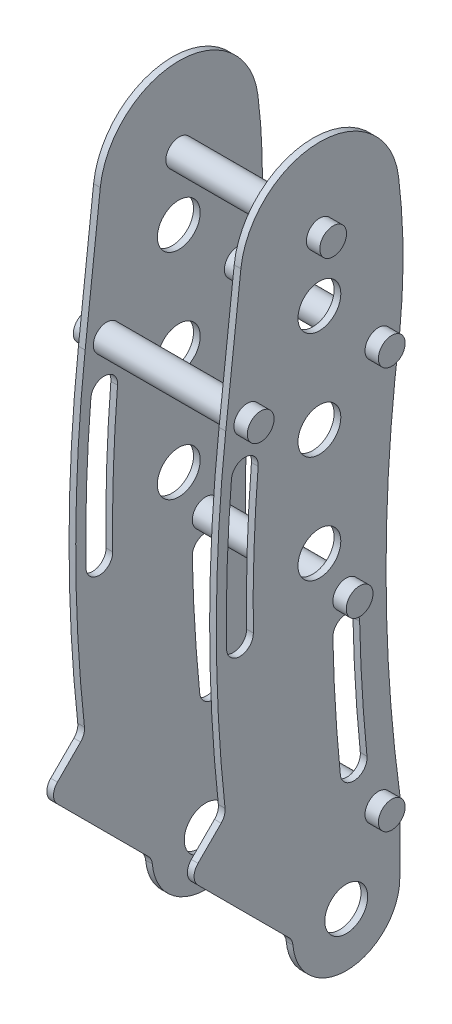
from build123d import *

# Parameters (mm, degrees)
DODANIE_WYCI_GNI_CIE1_DEPTH      = 27.5
DODANIE_WYCI_GNI_CIE1_DEPTH_BACK = 27.5
SZKIC1_R                         = 8
WYTNIJ_WYCI_GNI_CIE3_DEPTH       = 262.225344217
WYTNIJ_WYCI_GNI_CIE3_DEPTH_BACK  = 262.225344217
SZKIC2_W                         = 50
SZKIC2_H                         = 271.010465283
DODANIE_WYCI_GNI_CIE2_DEPTH      = 32.5
DODANIE_WYCI_GNI_CIE2_DEPTH_BACK = 32.5
SZKIC4_R                         = 5
WYTNIJ_WYCI_GNI_CIE4_DEPTH       = 262.79893136
WYTNIJ_WYCI_GNI_CIE4_DEPTH_BACK  = 262.79893136
SZKIC5_W                         = 50
SZKIC5_H                         = 2
SZKIC7_R                         = 8
WYTNIJ_WYCI_GNI_CIE5_DEPTH       = 267.612885025
ZAOKR_GLENIE1_R                  = 5


with BuildPart() as part:
    # Szkic1 → Dodanie-wyciągnięcie1 (new, two sides: drawn at the far end of the back side and taken through both)
    with BuildSketch(Plane(origin=(0, 0, 0), x_dir=(0, 0, -1), z_dir=(1, 0, 0)).offset(-DODANIE_WYCI_GNI_CIE1_DEPTH_BACK)):
        with BuildLine():
            Line((20, 0), (20, 26.995226764))
            ThreePointArc((20, 26.995226764), (14.862367943, 101.995226764), (20, 176.995226764))
            ThreePointArc((20, 176.995226764), (21.196911631, 202.008236386), (19.543563623, 226.995226764))
            ThreePointArc((19.543563623, 226.995226764), (-10.032375571, 253.010105435), (-39.350561597, 226.705085769))
            Line((-39.350561597, 226.705085769), (-45, 176.995226764))
            ThreePointArc((-45, 176.995226764), (-48.517838539, 114.888486347), (-45, 52.781745931))
            Line((-45, 52.781745931), (-58.890872965, 38.890872965))
            Line((-58.890872965, 38.890872965), (-20, 0))
            ThreePointArc((-20, 0), (0, -20), (20, 0))
        make_face()
        Circle(SZKIC1_R, mode=Mode.SUBTRACT)
    extrude(amount=DODANIE_WYCI_GNI_CIE1_DEPTH + DODANIE_WYCI_GNI_CIE1_DEPTH_BACK)

    # Szkic2 → Wytnij-wyciągnięcie3 (cut, two sides: drawn at the far end of the back side and taken through both)
    with BuildSketch(Plane.XY.offset(-WYTNIJ_WYCI_GNI_CIE3_DEPTH_BACK)):
        with Locations((0, 115.505232642)):
            Rectangle(SZKIC2_W, SZKIC2_H)
    extrude(amount=WYTNIJ_WYCI_GNI_CIE3_DEPTH + WYTNIJ_WYCI_GNI_CIE3_DEPTH_BACK, mode=Mode.SUBTRACT)

    # Szkic4 → Dodanie-wyciągnięcie2 (add, two sides: drawn at the far end of the back side and taken through both)
    with BuildSketch(Plane(origin=(0, 0, 0), x_dir=(0, 0, -1), z_dir=(1, 0, 0)).offset(-DODANIE_WYCI_GNI_CIE2_DEPTH_BACK)):
        with Locations((12, 26.995226764)):
            Circle(SZKIC4_R)
        with Locations((0, 101.995226764)):
            Circle(SZKIC4_R)
        with Locations((12, 176.995226764)):
            Circle(SZKIC4_R)
        with Locations((-36.948502055, 176.995226764)):
            Circle(SZKIC4_R)
        with Locations((-9.886287655, 223.356522646)):
            Circle(SZKIC4_R)
    extrude(amount=DODANIE_WYCI_GNI_CIE2_DEPTH + DODANIE_WYCI_GNI_CIE2_DEPTH_BACK)

    # Szkic5 → Wytnij-wyciągnięcie4 (cut, two sides: drawn at the far end of the back side and taken through both)
    with BuildSketch(Plane.XY.offset(-WYTNIJ_WYCI_GNI_CIE4_DEPTH_BACK)):
        with Locations((0, 252.010465283)):
            Rectangle(SZKIC5_W, SZKIC5_H)
    extrude(amount=WYTNIJ_WYCI_GNI_CIE4_DEPTH + WYTNIJ_WYCI_GNI_CIE4_DEPTH_BACK, mode=Mode.SUBTRACT)

    # Szkic7 → Wytnij-wyciągnięcie5 (cut, through all)
    with BuildSketch(Plane(origin=(27.5, 0, 0), x_dir=(0, 0, -1), z_dir=(1, 0, 0))):
        with Locations((-10.032375571, 200)):
            Circle(SZKIC7_R)
        with Locations((-10.032375571, 160)):
            Circle(SZKIC7_R)
        with Locations((-10.032375571, 120)):
            Circle(SZKIC7_R)
        with BuildLine():
            ThreePointArc((-42.868867151, 160.416733268), (-44.454199067, 133.445260635), (-44.703970192, 106.428391318))
            ThreePointArc((-44.703970192, 106.428391318), (-39.627132181, 101.506428721), (-34.705169584, 106.583266732))
            ThreePointArc((-34.705169584, 106.583266732), (-34.459970914, 133.105549545), (-32.903661004, 159.583266732))
            ThreePointArc((-32.903661004, 159.583266732), (-37.46953081, 164.982603073), (-42.868867151, 160.416733268))
        make_face()
        with BuildLine():
            ThreePointArc((-4.998947211, 90.299199015), (-4.066241956, 67.369334541), (-2.211268005, 44.495600794))
            ThreePointArc((-2.211268005, 44.495600794), (3.267624284, 40.025506916), (7.737718162, 45.504399206))
            ThreePointArc((7.737718162, 45.504399206), (5.91528868, 67.976826233), (4.998947211, 90.504399206))
            ThreePointArc((4.998947211, 90.504399206), (-0.102600095, 95.400746322), (-4.998947211, 90.299199015))
        make_face()
    extrude(amount=-WYTNIJ_WYCI_GNI_CIE5_DEPTH, mode=Mode.SUBTRACT)

    # Zaokrąglenie1
    zaokr_glenie1_edges = [part.edges().sort_by_distance(p)[0] for p in [
        (-26.25, 26.995226764, -20),
        (26.25, 26.995226764, -20),
        (-26.25, 0, 20),
        (26.25, 0, 20),
        (-26.25, 52.781745931, 45),
        (26.25, 52.781745931, 45),
        (-26.25, 38.890872965, 58.890872965),
        (26.25, 38.890872965, 58.890872965),
    ]]
    fillet(zaokr_glenie1_edges, radius=ZAOKR_GLENIE1_R)


solid = part.part
